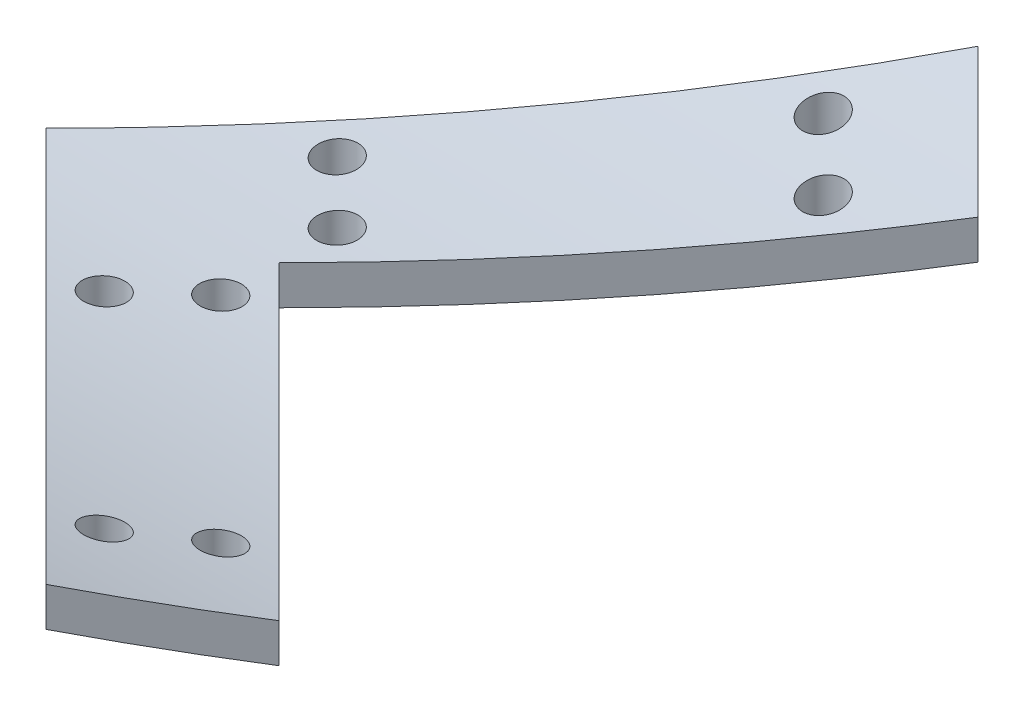
from build123d import *

# Parameters (mm, degrees)
BOSS_EXTRUDE4_DEPTH = 304.8
SKETCH4_OUTSIDE_W   = 384.928
SKETCH4_OUTSIDE_H   = 321.428
CUT_EXTRUDE2_DEPTH  = 150
SKETCH6_R           = 3.175
CUT_EXTRUDE5_DEPTH  = 150


with BuildPart() as part:
    # Sketch3 → Boss-Extrude4 (new body)
    with BuildSketch(Plane(origin=(0, 0, 0), x_dir=(0, 0, -1), z_dir=(1, 0, 0))):
        with BuildLine():
            ThreePointArc((232.90669496, 1.961354585), (112.25669496, -30.366715482), (-8.39330504, 1.961354585))
            Line((-8.39330504, 1.961354585), (-8.39330504, -4.052041589))
            ThreePointArc((-8.39330504, -4.052041589), (112.25669496, -36.380111656), (232.90669496, -4.052041589))
            Line((232.90669496, -4.052041589), (232.90669496, 1.961354585))
        make_face()
    extrude(amount=BOSS_EXTRUDE4_DEPTH)

    # Sketch4 outside → Cut-Extrude2 (cut)
    with BuildSketch(Plane(origin=(0, 1.961354585, 0), x_dir=(1, 0, 0), z_dir=(0, 1, 0))):
        with Locations((152.4, 112.257)):
            Rectangle(SKETCH4_OUTSIDE_W, SKETCH4_OUTSIDE_H)
        Polygon((105.356331211, 184.098739751), (33.514261355, 112.256736733), (105.356310324, 40.414687765), (123.316822566, 58.375200007), (69.435327613, 112.25669496), (123.316851808, 166.138219154), align=None, mode=Mode.SUBTRACT)
    extrude(amount=-CUT_EXTRUDE2_DEPTH, mode=Mode.SUBTRACT)

    # Sketch6 → Cut-Extrude5 (cut)
    with BuildSketch(Plane(origin=(0, 1.961354585, 0), x_dir=(1, 0, 0), z_dir=(0, 1, 0))):
        with Locations(Location((97.916821174, 167.678955491, 0), (0, 0, 270))):
            Circle(SKETCH6_R)
        with Locations(Location((106.897078687, 158.698700762, 0), (0, 0, 270))):
            Circle(SKETCH6_R)
        with Locations(Location((60.455057568, 130.217250368, 0), (0, 0, 270))):
            Circle(SKETCH6_R)
        with Locations(Location((69.435303942, 121.2369845, 0), (0, 0, 270))):
            Circle(SKETCH6_R)
        with Locations(Location((60.455015794, 94.296160438, 0), (0, 0, 270))):
            Circle(SKETCH6_R)
        with Locations(Location((69.435283055, 103.27640542, 0), (0, 0, 270))):
            Circle(SKETCH6_R)
        with Locations(Location((106.89697067, 65.814602027, 0), (0, 0, 270))):
            Circle(SKETCH6_R)
        with Locations(Location((97.916692269, 56.834368185, 0), (0, 0, 270))):
            Circle(SKETCH6_R)
    extrude(amount=-CUT_EXTRUDE5_DEPTH, mode=Mode.SUBTRACT)


solid = part.part
